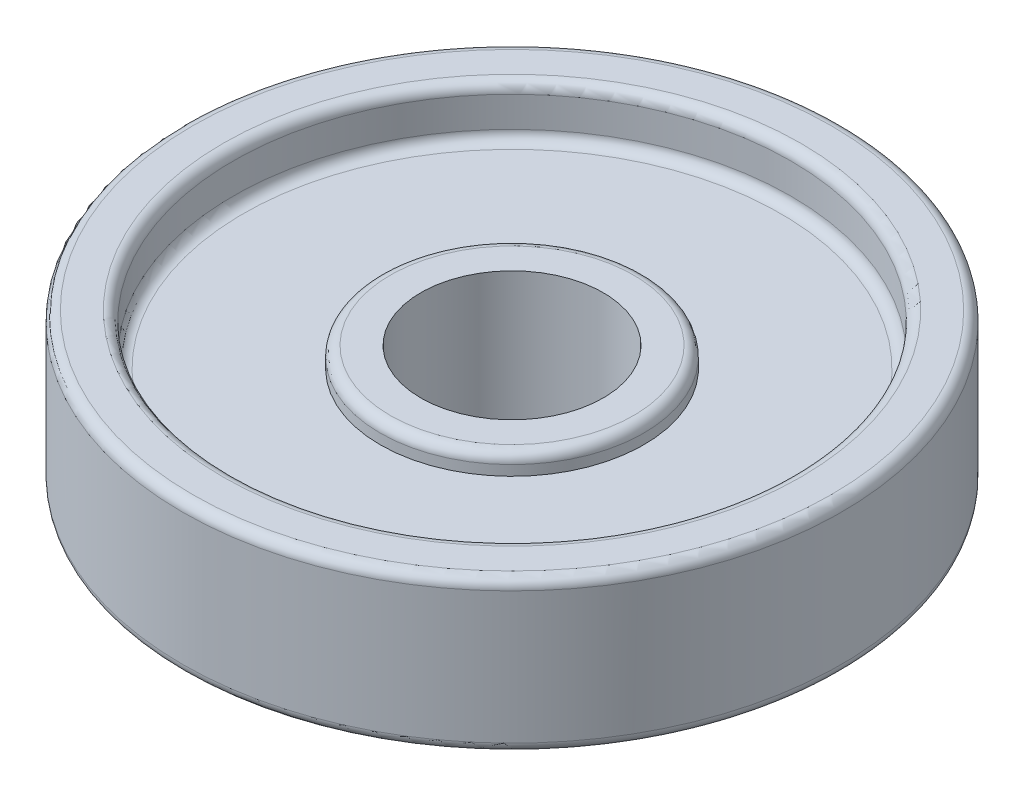
from build123d import *

# Parameters (mm, degrees)
FILLET1_R = 1


with BuildPart() as part:
    # Sketch1 → Revolve1 (revolve)
    with BuildSketch(Plane.XY, mode=Mode.PRIVATE) as revolve1_sk:
        Polygon((-9, 16), (-13, 16), (-13, 14), (-27.5, 14), (-27.5, 19), (-32.5, 19), (-32.5, 4), (-27.5, 4), (-27.5, 9), (-13, 9), (-13, 0), (-9, 0), align=None)
    revolve(revolve1_sk.sketch.rotate(Axis((0, 19, 0), (0, -1, 0)), 270), axis=Axis((0, 19, 0), (0, -1, 0)))

    # Fillet1
    fillet1_edges = [part.edges().sort_by_distance(p)[0] for p in [
        (0, 4, -27.5),
        (0, 4, -32.5),
        (0, 19, -32.5),
        (0, 19, -27.5),
        (0, 14, -27.5),
        (0, 16, -13),
        (0, 0, -13),
        (0, 9, -27.5),
    ]]
    fillet(fillet1_edges, radius=FILLET1_R)


solid = part.part
